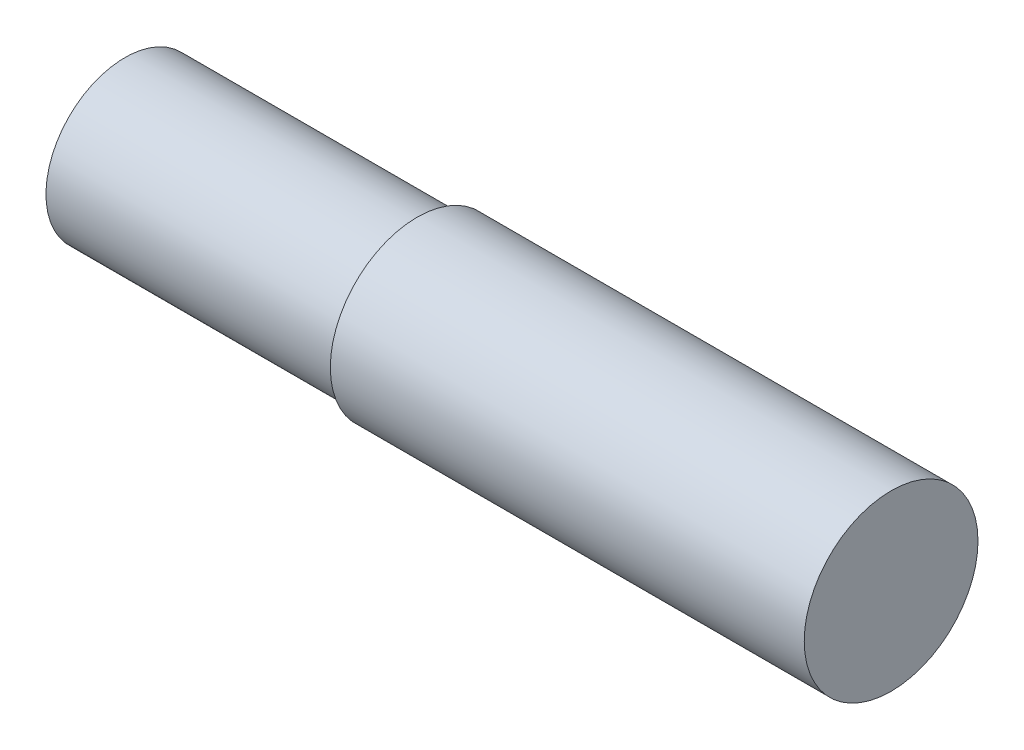
from build123d import *

# Parameters (mm, degrees)
ESQUISSE2_OUTSIDE_W = 23.186
ESQUISSE2_OUTSIDE_H = 23.186
ESQUISSE2_OUTSIDE_R = 5
EXTRUSION1_DEPTH    = 18.5


with BuildPart() as part:
    # Esquisse1 → Révolution1 (revolve)
    with BuildSketch(Plane.XY, mode=Mode.PRIVATE) as r_volution1_sk:
        Polygon((0, 0), (-48.5, 0), (-48.5, -2.5), (-35.5, -2.5), (-35.5, -5.5), (0, -5.5), align=None)
    revolve(r_volution1_sk.sketch.rotate(Axis((-35.5, -5.5, 0), (1, 0, 0)), 180), axis=Axis((-35.5, -5.5, 0), (1, 0, 0)))

    # Esquisse2 outside → Extrusion1 (cut)
    with BuildSketch(Plane.ZY.offset(48.5)):
        with Locations((0, -5.5)):
            Rectangle(ESQUISSE2_OUTSIDE_W, ESQUISSE2_OUTSIDE_H)
        with Locations(Location((0, -5.5, 0), (0, 0, 270))):
            Circle(ESQUISSE2_OUTSIDE_R, mode=Mode.SUBTRACT)
    extrude(amount=-EXTRUSION1_DEPTH, mode=Mode.SUBTRACT)


solid = part.part
